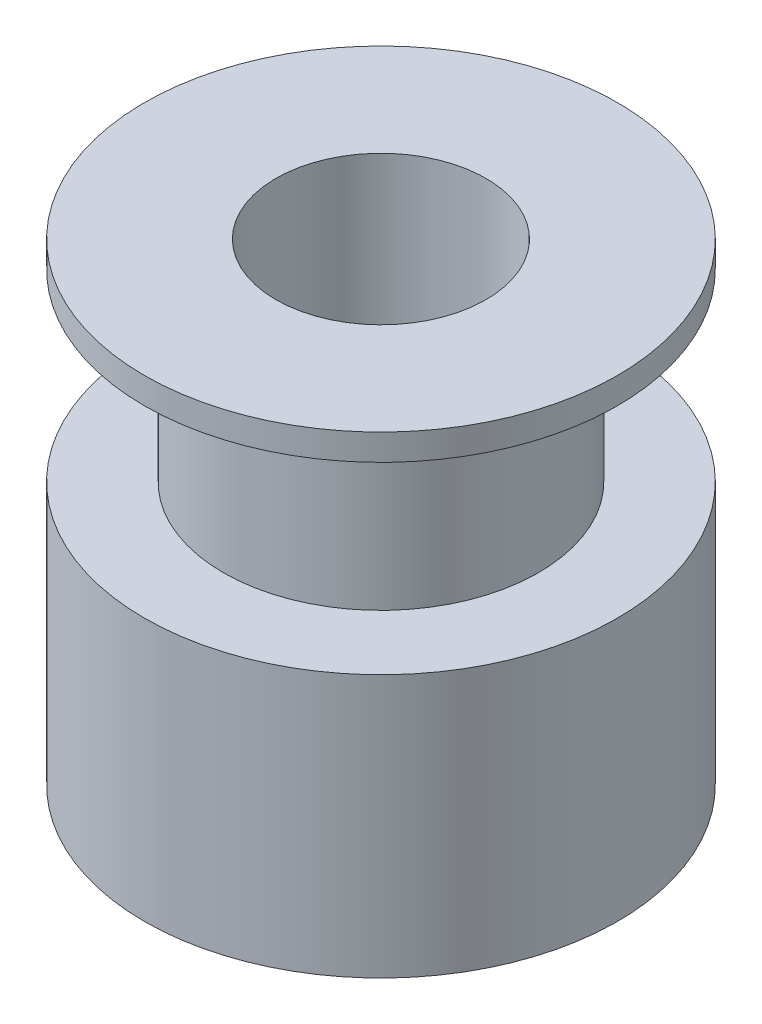
from build123d import *

# Parameters (mm, degrees)
SKETCH1_R           = 9
BOSS_EXTRUDE1_DEPTH = 18
SKETCH2_R           = 4
CUT_EXTRUDE1_DEPTH  = 23.045407685
CUT_EXTRUDE2_START  = -1
SKETCH3_R           = 10
SKETCH3_R_2         = 6
CUT_EXTRUDE2_DEPTH  = 7


with BuildPart() as part:
    # Sketch1 → Boss-Extrude1 (new body)
    with BuildSketch(Plane(origin=(0, 0, 0), x_dir=(1, 0, 0), z_dir=(0, 1, 0))):
        with Locations(Location((0, 0, 0), (0, 0, 270))):
            Circle(SKETCH1_R)
    extrude(amount=BOSS_EXTRUDE1_DEPTH)

    # Sketch2 → Cut-Extrude1 (cut, through all)
    with BuildSketch(Plane(origin=(0, 18, 0), x_dir=(1, 0, 0), z_dir=(0, 1, 0))):
        with Locations(Location((0, 0, 0), (0, 0, 270))):
            Circle(SKETCH2_R)
    extrude(amount=-CUT_EXTRUDE1_DEPTH, mode=Mode.SUBTRACT)

    # Sketch3 → Cut-Extrude2 (cut)
    with BuildSketch(Plane(origin=(0, 18, 0), x_dir=(1, 0, 0), z_dir=(0, 1, 0)).offset(CUT_EXTRUDE2_START)):
        Circle(SKETCH3_R)
        with Locations(Location((0, 0, 0), (0, 0, 270))):
            Circle(SKETCH3_R_2, mode=Mode.SUBTRACT)
    extrude(amount=-CUT_EXTRUDE2_DEPTH, mode=Mode.SUBTRACT)


solid = part.part
